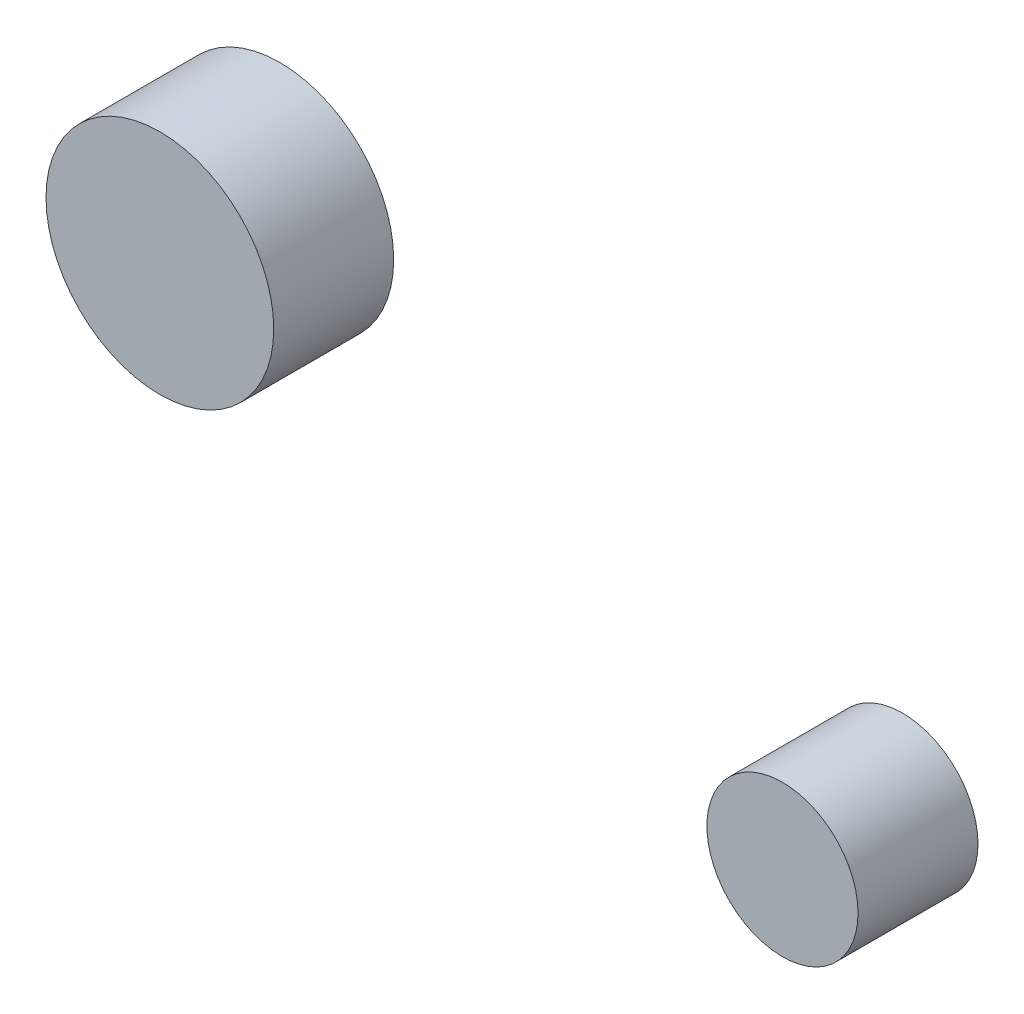
from build123d import *

# Parameters (mm, degrees)
CURVESKETCH_R     = 11.137
CURVEBOSS_DEPTH   = 11.731
CURVESKETCH_R_2   = 7.391
CURVEBOSS_2_DEPTH = 11.731


with BuildPart() as part:
    # CurveSketch → CurveBoss (new body)
    with BuildSketch(Plane.XY):
        with Locations((-31.719, 7.193)):
            Circle(CURVESKETCH_R)
    extrude(amount=CURVEBOSS_DEPTH)


with BuildPart() as body_2:
    # CurveSketch → CurveBoss 2 (new body)
    with BuildSketch(Plane.XY):
        with Locations((29.173, -13.719)):
            Circle(CURVESKETCH_R_2)
    extrude(amount=CURVEBOSS_2_DEPTH)


solid = Compound([part.part, body_2.part])
